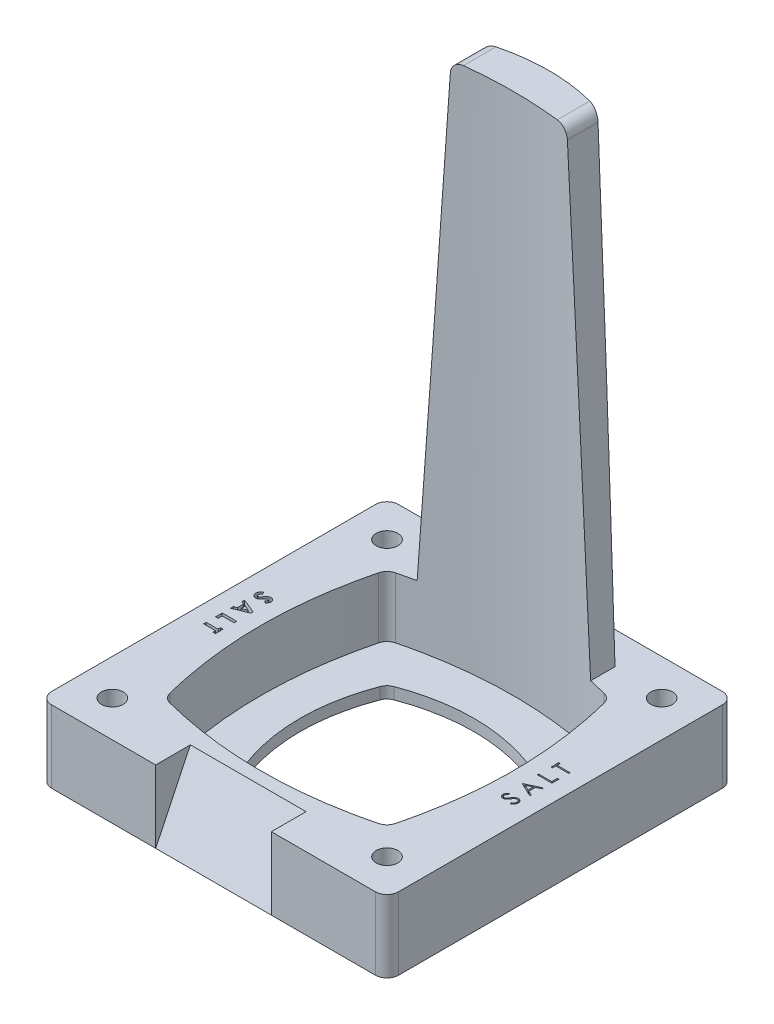
from build123d import *

# Parameters (mm, degrees)
SKETCH1_W           = 76.2
SKETCH1_H           = 76.2
BOSS_EXTRUDE1_DEPTH = 15.875
CUT_EXTRUDE1_DEPTH  = 13.335
SKETCH4_R           = 2.38125
CUT_EXTRUDE3_DEPTH  = 57.171484227
FILLET2_R           = 2.54
CUT_EXTRUDE4_DEPTH  = 56.507136865
FILLET3_R           = 2.54
BOSS_EXTRUDE2_DEPTH = 101.6
CUT_EXTRUDE5_DEPTH  = 130.242391125
FILLET4_R           = 2.54
CUT_EXTRUDE6_DEPTH  = 12.7
CUT_EXTRUDE7_DEPTH  = 1.27


with BuildPart() as part:
    # Sketch1 → Boss-Extrude1 (new body)
    with BuildSketch(Plane(origin=(0, 0, 0), x_dir=(1, 0, 0), z_dir=(0, 1, 0))):
        Rectangle(SKETCH1_W, SKETCH1_H)
    extrude(amount=BOSS_EXTRUDE1_DEPTH)

    # Sketch2 → Cut-Extrude1 (cut)
    with BuildSketch(Plane(origin=(0, 15.875, 0), x_dir=(1, 0, 0), z_dir=(0, 1, 0))):
        with BuildLine():
            add(Edge.make_bspline(
                [(-24.384, 24.384), (-30.988, 0), (-24.384, -24.384)],
                knots=[0, 0, 0, 1, 1, 1], degree=2))
            add(Edge.make_bspline(
                [(24.384, -24.384), (0, -30.988), (-24.384, -24.384)],
                knots=[0, 0, 0, 1, 1, 1], degree=2))
            add(Edge.make_bspline(
                [(24.384, 24.384), (30.988, 0), (24.384, -24.384)],
                knots=[0, 0, 0, 1, 1, 1], degree=2))
            add(Edge.make_bspline(
                [(-24.384, 24.384), (0, 30.988), (24.384, 24.384)],
                knots=[0, 0, 0, 1, 1, 1], degree=2))
        make_face()
    extrude(amount=-CUT_EXTRUDE1_DEPTH, mode=Mode.SUBTRACT)

    # Sketch4 → Cut-Extrude3 (cut, through all)
    with BuildSketch(Plane(origin=(0, 15.875, 0), x_dir=(1, 0, 0), z_dir=(0, 1, 0))):
        with Locations(Location((-30.1625, 30.1625, 0), (0, 0, 270))):
            Circle(SKETCH4_R)
        with Locations(Location((30.1625, 30.1625, 0), (0, 0, 270))):
            Circle(SKETCH4_R)
        with Locations(Location((30.1625, -30.1625, 0), (0, 0, 270))):
            Circle(SKETCH4_R)
        with Locations(Location((-30.1625, -30.1625, 0), (0, 0, 270))):
            Circle(SKETCH4_R)
    extrude(amount=-CUT_EXTRUDE3_DEPTH, mode=Mode.SUBTRACT)

    # Fillet2
    fillet2_edges = [part.edges().sort_by_distance(p)[0] for p in [
        (38.1, 7.9375, 38.1),
        (-38.1, 7.9375, 38.1),
        (-38.1, 7.9375, -38.1),
        (38.1, 7.9375, -38.1),
    ]]
    fillet(fillet2_edges, radius=FILLET2_R)

    # Sketch8 → Cut-Extrude4 (cut, through all)
    with BuildSketch(Plane(origin=(0, 2.54, 0), x_dir=(1, 0, 0), z_dir=(0, 1, 0))):
        with BuildLine():
            add(Edge.make_bspline(
                [(-15.875, 15.875), (-22.225, 0), (-15.875, -15.875)],
                knots=[0, 0, 0, 1, 1, 1], degree=2))
            add(Edge.make_bspline(
                [(15.875, -15.875), (0, -22.225), (-15.875, -15.875)],
                knots=[0, 0, 0, 1, 1, 1], degree=2))
            add(Edge.make_bspline(
                [(15.875, 15.875), (22.225, 0), (15.875, -15.875)],
                knots=[0, 0, 0, 1, 1, 1], degree=2))
            add(Edge.make_bspline(
                [(-15.875, 15.875), (0, 22.225), (15.875, 15.875)],
                knots=[0, 0, 0, 1, 1, 1], degree=2))
        make_face()
    extrude(amount=-CUT_EXTRUDE4_DEPTH, mode=Mode.SUBTRACT)

    # Fillet3
    fillet3_edges = [part.edges().sort_by_distance(p)[0] for p in [
        (15.875, 1.27, -15.875),
        (15.875, 1.27, 15.875),
        (-15.875, 1.27, 15.875),
        (-15.875, 1.27, -15.875),
        (-24.384, 9.2075, -24.384),
        (-24.384, 9.2075, 24.384),
        (24.384, 9.2075, 24.384),
        (24.384, 9.2075, -24.384),
    ]]
    fillet(fillet3_edges, radius=FILLET3_R)

    # Sketch9 → Boss-Extrude2 (add)
    with BuildSketch(Plane(origin=(0, 15.875, 0), x_dir=(1, 0, 0), z_dir=(0, 1, 0))):
        with BuildLine():
            Line((-26.67, 26.67), (-24.384, 24.384))
            add(Edge.make_bspline(
                [(-24.384, 24.384), (0, 30.988), (24.384, 24.384)],
                knots=[0, 0, 0, 1, 1, 1], degree=2))
            Line((24.384, 24.384), (26.67, 26.67))
            add(Edge.make_bspline(
                [(-26.67, 26.67), (0, 44.45), (26.67, 26.67)],
                knots=[0, 0, 0, 1, 1, 1], degree=2))
        make_face()
    extrude(amount=BOSS_EXTRUDE2_DEPTH)

    # Sketch10 → Cut-Extrude5 (cut, through all)
    with BuildSketch(Plane.XY):
        Polygon((-12.7, 117.475), (-19.05, 15.875), (-26.67, 15.875), (-26.67, 117.475), align=None)
        Polygon((12.7, 117.475), (19.05, 15.875), (26.67, 15.875), (26.67, 117.475), align=None)
    extrude(amount=-CUT_EXTRUDE5_DEPTH, mode=Mode.SUBTRACT)

    # Fillet4
    fillet4_edges = [part.edges().sort_by_distance(p)[0] for p in [
        (12.7, 117.475, -30.167201079),
        (-12.7, 117.475, -30.167201079),
    ]]
    fillet(fillet4_edges, radius=FILLET4_R)

    # Sketch11 → Cut-Extrude6 (cut, symmetric)
    with BuildSketch(Plane(origin=(0, 0, 0), x_dir=(0, 0, -1), z_dir=(1, 0, 0))):
        Polygon((-30.48, 15.875), (-38.1, 0), (-38.1, 15.875), align=None)
    extrude(amount=CUT_EXTRUDE6_DEPTH, both=True, mode=Mode.SUBTRACT)

    # Sketch12 → Cut-Extrude7 (cut)
    # profile 1 of 8: a face of its own
    with BuildSketch(Plane(origin=(0, 15.875, 0), x_dir=(1, 0, 0), z_dir=(0, 1, 0))):
        with BuildLine():
            Line((-31.539223758, 4.701442308), (-31.929102564, 5.127574119))
            add(Edge.make_bspline(
                [(-31.929102564, 5.127574119), (-31.90334928, 5.145824266), (-31.853906565, 5.180862003), (-31.787773878, 5.237711608), (-31.730987674, 5.294221577), (-31.685171539, 5.351547314), (-31.648288106, 5.40870185), (-31.622848116, 5.466899463), (-31.606487506, 5.525470629), (-31.604460135, 5.564842079), (-31.603461538, 5.584234776)],
                knots=[0, 0, 0, 0, 1.299459705, 2.494781419, 3.587730629, 4.594196874, 5.512431013, 6.380462003, 7.202284646, 8, 8, 8, 8], degree=3))
            add(Edge.make_bspline(
                [(-31.603461538, 5.584234776), (-31.604095863, 5.602322209), (-31.605320578, 5.63724429), (-31.617494153, 5.687028307), (-31.638503956, 5.731227267), (-31.66597604, 5.769798033), (-31.699073533, 5.80035177), (-31.733784293, 5.824746559), (-31.772097121, 5.838482876), (-31.798411918, 5.840290845), (-31.811439303, 5.841185897)],
                knots=[0, 0, 0, 0, 1.185010067, 2.2879431, 3.333075148, 4.379039566, 5.372662701, 6.27520591, 7.14612461, 8, 8, 8, 8], degree=3))
            add(Edge.make_bspline(
                [(-31.811439303, 5.841185897), (-31.824654549, 5.840625014), (-31.851268217, 5.839495472), (-31.890273863, 5.828585633), (-31.92838692, 5.812141391), (-31.951588151, 5.796428246), (-31.963447516, 5.788396434)],
                knots=[0, 0, 0, 0, 0.967525499, 1.948461899, 2.951351359, 4, 4, 4, 4], degree=3))
            add(Edge.make_bspline(
                [(-31.963447516, 5.788396434), (-31.972664567, 5.781093581), (-31.993881002, 5.764283377), (-32.027514428, 5.732259336), (-32.068440273, 5.691986792), (-32.116434363, 5.642638643), (-32.170871405, 5.584275433), (-32.232069818, 5.516380632), (-32.300413726, 5.439913482), (-32.348070362, 5.385624433), (-32.373042869, 5.357176482)],
                knots=[0, 0, 0, 0, 0.473868417, 1.090782513, 1.870421581, 2.78911798, 3.865477667, 5.087766164, 6.473963263, 8, 8, 8, 8], degree=3))
            add(Edge.make_bspline(
                [(-32.373042869, 5.357176482), (-32.396157108, 5.330468699), (-32.440023131, 5.279782876), (-32.502283908, 5.207667015), (-32.558298411, 5.144289184), (-32.607225982, 5.088726112), (-32.649579984, 5.041820082), (-32.685562867, 5.003373901), (-32.714474112, 4.972918012), (-32.731936522, 4.955605623), (-32.739389022, 4.948217147)],
                knots=[0, 0, 0, 0, 1.543621617, 2.929473131, 4.163658386, 5.240097082, 6.164993805, 6.925417477, 7.541396219, 8, 8, 8, 8], degree=3))
            add(Edge.make_bspline(
                [(-32.739389022, 4.948217147), (-32.769712969, 4.920170829), (-32.828006242, 4.866255955), (-32.918609813, 4.796365702), (-33.006450958, 4.737968856), (-33.094228703, 4.693264821), (-33.182997385, 4.660542209), (-33.274285521, 4.636575422), (-33.369659972, 4.622422931), (-33.434721592, 4.620835142), (-33.467629207, 4.620032051)],
                knots=[0, 0, 0, 0, 1.20648512, 2.3192881, 3.339983362, 4.284774958, 5.190427137, 6.099526693, 7.038756749, 8, 8, 8, 8], degree=3))
            add(Edge.make_bspline(
                [(-33.467629207, 4.620032051), (-33.499695024, 4.620600768), (-33.562609351, 4.621716613), (-33.654679367, 4.635368766), (-33.742778036, 4.654863757), (-33.826022738, 4.684903259), (-33.905400171, 4.721824111), (-33.980936356, 4.766821951), (-34.050870359, 4.821835457), (-34.117079432, 4.882942605), (-34.17653746, 4.951577998), (-34.228852022, 5.025427428), (-34.273370098, 5.104352997), (-34.308628113, 5.188649162), (-34.336940573, 5.277799923), (-34.357059122, 5.371917983), (-34.369491274, 5.471113411), (-34.370761379, 5.538828093), (-34.371410256, 5.573422476)],
                knots=[0, 0, 0, 0, 1.043082113, 2.046565928, 3.024368146, 3.976196322, 4.921091788, 5.871642728, 6.831173094, 7.81279273, 8.801063391, 9.781590382, 10.755046466, 11.74476232, 12.751114423, 13.796272686, 14.874149815, 16, 16, 16, 16], degree=3))
            add(Edge.make_bspline(
                [(-34.371410256, 5.573422476), (-34.370928674, 5.600577189), (-34.369974864, 5.654359094), (-34.362182929, 5.733624363), (-34.349619668, 5.810168261), (-34.331570529, 5.883884489), (-34.308908965, 5.954991454), (-34.280708006, 6.023423061), (-34.247515147, 6.089106849), (-34.209311506, 6.152465759), (-34.164977118, 6.213063076), (-34.115433842, 6.271713479), (-34.059607727, 6.327684393), (-33.998587537, 6.38212378), (-33.930809473, 6.433106757), (-33.858228699, 6.483247413), (-33.779134234, 6.530118687), (-33.723659024, 6.559083581), (-33.695323518, 6.573878205)],
                knots=[0, 0, 0, 0, 1.016957334, 2.014158747, 2.980235577, 3.920141478, 4.854360818, 5.773095257, 6.689355356, 7.608638744, 8.541033765, 9.498850575, 10.481527934, 11.499755671, 12.559141621, 13.65604909, 14.802761907, 16, 16, 16, 16], degree=3))
            Line((-33.695323518, 6.573878205), (-33.394487179, 6.072696314))
            add(Edge.make_bspline(
                [(-33.394487179, 6.072696314), (-33.426652663, 6.054191679), (-33.488316645, 6.018716711), (-33.57117002, 5.958601062), (-33.642120221, 5.897015649), (-33.699913198, 5.832536672), (-33.745321719, 5.765948171), (-33.777773798, 5.696928508), (-33.797861598, 5.625429192), (-33.800314782, 5.576727106), (-33.801538462, 5.552433894)],
                knots=[0, 0, 0, 0, 1.283663364, 2.460892379, 3.537111102, 4.529833553, 5.449777664, 6.316464042, 7.160231139, 8, 8, 8, 8], degree=3))
            add(Edge.make_bspline(
                [(-33.801538462, 5.552433894), (-33.800548635, 5.52771967), (-33.798628227, 5.479770474), (-33.78053993, 5.411216463), (-33.75277678, 5.348088088), (-33.712399548, 5.293813718), (-33.666357758, 5.247724344), (-33.61442987, 5.214682999), (-33.5589196, 5.193250233), (-33.520183941, 5.191023677), (-33.500702123, 5.189903846)],
                knots=[0, 0, 0, 0, 1.13537643, 2.202795631, 3.242191317, 4.290390765, 5.297919085, 6.223733717, 7.106639842, 8, 8, 8, 8], degree=3))
            add(Edge.make_bspline(
                [(-33.500702123, 5.189903846), (-33.482586559, 5.190952039), (-33.445786526, 5.193081344), (-33.391039028, 5.208679787), (-33.336556999, 5.233269536), (-33.291396406, 5.261489162), (-33.253753173, 5.290909641), (-33.221627446, 5.319747347), (-33.185391531, 5.353925017), (-33.146033543, 5.394313515), (-33.102796752, 5.440127294), (-33.055783958, 5.491516336), (-33.005378385, 5.549034055), (-32.971044009, 5.589689326), (-32.953090946, 5.610947516)],
                knots=[0, 0, 0, 0, 0.916057066, 1.860882232, 2.859899639, 3.934694552, 4.546382938, 5.276161949, 6.118633209, 7.067046139, 8.129668089, 9.306861125, 10.591787583, 12, 12, 12, 12], degree=3))
            add(Edge.make_bspline(
                [(-32.953090946, 5.610947516), (-32.918896967, 5.651358634), (-32.853268374, 5.7289198), (-32.756356584, 5.838543679), (-32.665714834, 5.937253946), (-32.580623832, 6.024400518), (-32.501608539, 6.100215791), (-32.42942167, 6.165618041), (-32.362598747, 6.219183137), (-32.283317923, 6.275493452), (-32.187216408, 6.329855646), (-32.070979105, 6.37596492), (-31.955004328, 6.406047538), (-31.877121446, 6.409405117), (-31.838788061, 6.411057692)],
                knots=[0, 0, 0, 0, 1.34561873, 2.582649632, 3.719171478, 4.751946187, 5.678152813, 6.502542634, 7.227205346, 7.853698961, 8.973370308, 10.023159194, 11.027013428, 12, 12, 12, 12], degree=3))
            add(Edge.make_bspline(
                [(-31.838788061, 6.411057692), (-31.811605937, 6.410367884), (-31.758054232, 6.409008887), (-31.679305232, 6.396921899), (-31.603354152, 6.378774417), (-31.530224114, 6.352691733), (-31.460724416, 6.317721035), (-31.393785558, 6.276365202), (-31.329524181, 6.227770596), (-31.270035587, 6.171367484), (-31.214773717, 6.110180427), (-31.166266245, 6.04464606), (-31.125470412, 5.975448668), (-31.09113176, 5.903077734), (-31.065288948, 5.826603231), (-31.046806835, 5.746720168), (-31.03584309, 5.663405528), (-31.034350217, 5.606740109), (-31.033589744, 5.577874599)],
                knots=[0, 0, 0, 0, 1.010961173, 1.991702108, 2.958025473, 3.913824419, 4.873522744, 5.847800578, 6.838738273, 7.865764422, 8.893759806, 9.903642949, 10.894078012, 11.878777586, 12.879248405, 13.891624672, 14.925988217, 16, 16, 16, 16], degree=3))
            add(Edge.make_bspline(
                [(-31.033589744, 5.577874599), (-31.034961925, 5.540467807), (-31.037695458, 5.465949499), (-31.058958268, 5.355738895), (-31.092751805, 5.248038904), (-31.132550524, 5.160976676), (-31.172352352, 5.092314817), (-31.208195551, 5.039515356), (-31.249513552, 4.985684305), (-31.296471034, 4.930544243), (-31.348754388, 4.874375385), (-31.407426808, 4.817650355), (-31.470575803, 4.758987322), (-31.515940238, 4.720960012), (-31.539223758, 4.701442308)],
                knots=[0, 0, 0, 0, 1.282867522, 2.555608537, 3.83715526, 5.14906667, 5.830341525, 6.558732832, 7.337173124, 8.157810814, 9.043130442, 9.96912168, 10.957641678, 12, 12, 12, 12], degree=3))
        make_face()
    # profile 2 of 8: a face of its own
    with BuildSketch(Plane(origin=(0, 15.875, 0), x_dir=(1, 0, 0), z_dir=(0, 1, 0))):
        Polygon((-31.115, 1.729331931), (-31.115, 1.200801282), (-34.29, -0.081410256), (-34.29, 0.527258614), (-33.638717949, 0.774033454), (-33.638717949, 2.157371795), (-34.29, 2.404146635), (-34.29, 3.012179487), align=None)
        Polygon((-31.966627604, 1.465384615), (-33.068846154, 1.941125801), (-33.068846154, 0.989643429), align=None, mode=Mode.SUBTRACT)
    # profile 3 of 8: a face of its own
    with BuildSketch(Plane(origin=(0, 15.875, 0), x_dir=(1, 0, 0), z_dir=(0, 1, 0))):
        Polygon((-31.115, -1.892788462), (-31.115, -2.462660256), (-33.720128205, -2.462660256), (-33.720128205, -3.358173077), (-34.29, -3.358173077), (-34.29, -1.892788462), align=None)
    # profile 4 of 8: a face of its own
    with BuildSketch(Plane(origin=(0, 15.875, 0), x_dir=(1, 0, 0), z_dir=(0, 1, 0))):
        Polygon((-31.115, -4.864262821), (-31.115, -6.573878205), (-31.684871795, -6.573878205), (-31.684871795, -6.00400641), (-34.29, -6.00400641), (-34.29, -5.434134615), (-31.684871795, -5.434134615), (-31.684871795, -4.864262821), align=None)
    # profile 5 of 8: a face of its own
    with BuildSketch(Plane(origin=(0, 15.875, 0), x_dir=(1, 0, 0), z_dir=(0, 1, 0))):
        Polygon((31.440641026, 4.945673077), (31.115, 4.945673077), (31.115, 6.614583333), (31.440641026, 6.614583333), (31.440641026, 5.922596154), (34.29, 5.922596154), (34.29, 5.637660256), (31.440641026, 5.637660256), align=None)
    # profile 6 of 8: a face of its own
    with BuildSketch(Plane(origin=(0, 15.875, 0), x_dir=(1, 0, 0), z_dir=(0, 1, 0))):
        Polygon((31.115, 1.93349359), (31.115, 2.218429487), (33.964358974, 2.218429487), (33.964358974, 3.439583333), (34.29, 3.439583333), (34.29, 1.93349359), align=None)
    # profile 7 of 8: a face of its own
    with BuildSketch(Plane(origin=(0, 15.875, 0), x_dir=(1, 0, 0), z_dir=(0, 1, 0))):
        Polygon((31.115, -1.363621795), (34.29, 0.101762821), (34.29, -0.207977764), (33.272371795, -0.677358774), (33.272371795, -2.116666667), (34.29, -2.599404046), (34.29, -2.910416667), (31.115, -1.404326923), align=None)
        Polygon((31.733845152, -1.387154447), (32.946730769, -1.962114383), (32.946730769, -0.827458934), align=None, mode=Mode.SUBTRACT)
    # profile 8 of 8: a face of its own
    with BuildSketch(Plane(origin=(0, 15.875, 0), x_dir=(1, 0, 0), z_dir=(0, 1, 0))):
        with BuildLine():
            Line((33.677515024, -6.533173077), (33.516602564, -6.264773638))
            add(Edge.make_bspline(
                [(33.516602564, -6.264773638), (33.558389542, -6.239810665), (33.638451779, -6.191982574), (33.746635858, -6.112198127), (33.838585815, -6.029527557), (33.913766737, -5.943358662), (33.972956799, -5.854217409), (34.014868823, -5.761521874), (34.04100903, -5.665584432), (34.044184108, -5.600293894), (34.045769231, -5.567698317)],
                knots=[0, 0, 0, 0, 1.272034388, 2.437168799, 3.508375237, 4.49857839, 5.41946034, 6.295179144, 7.148887113, 8, 8, 8, 8], degree=3))
            add(Edge.make_bspline(
                [(34.045769231, -5.567698317), (34.044975476, -5.539866587), (34.043401854, -5.484690115), (34.028892285, -5.403302257), (34.005154659, -5.324653869), (33.972975737, -5.249526766), (33.933420845, -5.179911324), (33.886778206, -5.117886425), (33.832884305, -5.065512974), (33.773735657, -5.02209475), (33.71030847, -4.988498044), (33.644955763, -4.963105327), (33.576780848, -4.948884037), (33.53086809, -4.946750009), (33.507698317, -4.945673077)],
                knots=[0, 0, 0, 0, 1.09553864, 2.171907928, 3.244545276, 4.325730702, 5.384330216, 6.391480148, 7.371786628, 8.333890167, 9.27165687, 10.191402356, 11.087295184, 12, 12, 12, 12], degree=3))
            add(Edge.make_bspline(
                [(33.507698317, -4.945673077), (33.48125458, -4.946981763), (33.42770313, -4.949631994), (33.348559073, -4.972988658), (33.269898664, -5.008653308), (33.221232969, -5.04217407), (33.196049679, -5.059520232)],
                knots=[0, 0, 0, 0, 0.938992559, 1.901562324, 2.914110574, 4, 4, 4, 4], degree=3))
            add(Edge.make_bspline(
                [(33.196049679, -5.059520232), (33.177862047, -5.073733634), (33.139679389, -5.103572893), (33.082891582, -5.154915228), (33.024196314, -5.214855243), (32.962305017, -5.282572562), (32.897731753, -5.358180777), (32.829972625, -5.44170914), (32.760412297, -5.533870518), (32.713820333, -5.598558279), (32.689779647, -5.631936098)],
                knots=[0, 0, 0, 0, 0.72225051, 1.516274602, 2.393638633, 3.3469932, 4.386926276, 5.505032946, 6.712638081, 8, 8, 8, 8], degree=3))
            add(Edge.make_bspline(
                [(32.689779647, -5.631936098), (32.665986572, -5.665340723), (32.620496022, -5.729207822), (32.552982565, -5.818523822), (32.491257054, -5.898392728), (32.434738415, -5.96845955), (32.38341898, -6.02869347), (32.337791564, -6.079569136), (32.296622191, -6.119790541), (32.269914688, -6.142156675), (32.257923678, -6.152198518)],
                knots=[0, 0, 0, 0, 1.452282411, 2.77665338, 3.964542531, 5.026858415, 5.96415736, 6.766646006, 7.446254459, 8, 8, 8, 8], degree=3))
            add(Edge.make_bspline(
                [(32.257923678, -6.152198518), (32.239234667, -6.166231974), (32.202480218, -6.193830649), (32.145048745, -6.230300478), (32.086370132, -6.261055584), (32.026231713, -6.285807694), (31.965085465, -6.305823787), (31.902472326, -6.319740107), (31.838817351, -6.328317833), (31.795989444, -6.329203887), (31.77455028, -6.329647436)],
                knots=[0, 0, 0, 0, 1.068019517, 2.100403715, 3.106014851, 4.09224787, 5.069873182, 6.043214339, 7.020455327, 8, 8, 8, 8], degree=3))
            add(Edge.make_bspline(
                [(31.77455028, -6.329647436), (31.740958919, -6.328463478), (31.674494189, -6.326120867), (31.577402888, -6.306307633), (31.484701659, -6.275038644), (31.397329623, -6.231217577), (31.317482025, -6.1747813), (31.244440161, -6.109186503), (31.182197866, -6.031782855), (31.128662953, -5.946091262), (31.086327298, -5.852787901), (31.055646501, -5.754559751), (31.037422493, -5.652112907), (31.03487988, -5.582611273), (31.033589744, -5.547345753)],
                knots=[0, 0, 0, 0, 1.005248779, 1.989011071, 2.95484373, 3.928844559, 4.904706341, 5.875556129, 6.859318422, 7.868909462, 8.894684146, 9.918924798, 10.944050749, 12, 12, 12, 12], degree=3))
            add(Edge.make_bspline(
                [(31.033589744, -5.547345753), (31.034862679, -5.509925404), (31.03739414, -5.435508273), (31.059952317, -5.326219585), (31.095854676, -5.220566822), (31.137977549, -5.135952853), (31.179780446, -5.069589547), (31.217939056, -5.019029853), (31.261777906, -4.967516671), (31.312221185, -4.915603615), (31.368259979, -4.862778194), (31.430368658, -4.809283736), (31.497987524, -4.754619624), (31.546271815, -4.719464498), (31.571024639, -4.701442308)],
                knots=[0, 0, 0, 0, 1.286507425, 2.558452658, 3.822738219, 5.118007103, 5.800084425, 6.519418873, 7.295692132, 8.12638276, 9.008892966, 9.945018126, 10.946518512, 12, 12, 12, 12], degree=3))
            Line((31.571024639, -4.701442308), (31.766282051, -4.959029447))
            add(Edge.make_bspline(
                [(31.766282051, -4.959029447), (31.746243294, -4.974582123), (31.707653332, -5.004532941), (31.653629065, -5.050022631), (31.604213272, -5.09283279), (31.561404692, -5.135333914), (31.521997652, -5.17425003), (31.488857607, -5.212691275), (31.46093749, -5.249174198), (31.43108717, -5.295050465), (31.402392591, -5.353165186), (31.377187777, -5.425508662), (31.362234936, -5.501366059), (31.360240457, -5.553004915), (31.359230769, -5.579146635)],
                knots=[0, 0, 0, 0, 1.181392137, 2.275085037, 3.289537922, 4.225335853, 5.084247276, 5.86831218, 6.587234301, 7.222706459, 8.415108401, 9.595592188, 10.782789524, 12, 12, 12, 12], degree=3))
            add(Edge.make_bspline(
                [(31.359230769, -5.579146635), (31.360311956, -5.611953506), (31.362396922, -5.675218466), (31.385767075, -5.764826937), (31.421299819, -5.845944964), (31.472537664, -5.915475881), (31.533623045, -5.972886481), (31.60328662, -6.014930463), (31.680227328, -6.040067821), (31.733873021, -6.04314459), (31.76119391, -6.044711538)],
                knots=[0, 0, 0, 0, 1.144248881, 2.206576175, 3.214949548, 4.222996039, 5.203671638, 6.127710127, 7.046472867, 8, 8, 8, 8], degree=3))
            add(Edge.make_bspline(
                [(31.76119391, -6.044711538), (31.778200279, -6.044334544), (31.812449923, -6.043575302), (31.862810058, -6.033873426), (31.91290466, -6.020755691), (31.962557422, -6.000645575), (32.012892698, -5.972640574), (32.064621432, -5.93590401), (32.118189187, -5.889625349), (32.153030249, -5.854177261), (32.17142528, -5.835461739)],
                knots=[0, 0, 0, 0, 0.858259122, 1.72847414, 2.583651051, 3.473048463, 4.427392529, 5.488649985, 6.674082839, 8, 8, 8, 8], degree=3))
            add(Edge.make_bspline(
                [(32.17142528, -5.835461739), (32.17762744, -5.82851178), (32.19236235, -5.812000267), (32.216485347, -5.781814249), (32.246242148, -5.741951853), (32.283060642, -5.693453999), (32.325770254, -5.635426464), (32.373824888, -5.567862867), (32.428784555, -5.491516333), (32.467208895, -5.437340024), (32.487526042, -5.40869391)],
                knots=[0, 0, 0, 0, 0.420754252, 0.999615792, 1.744751191, 2.668019286, 3.750313428, 4.999500688, 6.413464383, 8, 8, 8, 8], degree=3))
            add(Edge.make_bspline(
                [(32.487526042, -5.40869391), (32.512600721, -5.374235285), (32.561154363, -5.307510932), (32.634102633, -5.212571227), (32.705448215, -5.126490113), (32.77473086, -5.048958996), (32.841440523, -4.979233255), (32.906328062, -4.918015765), (32.968967955, -4.865028769), (33.048730082, -4.80720544), (33.147598158, -4.748821019), (33.268784801, -4.698761177), (33.390319212, -4.666913962), (33.471899388, -4.662777888), (33.512150441, -4.660737179)],
                knots=[0, 0, 0, 0, 1.163604038, 2.253157948, 3.268574773, 4.215621239, 5.091738613, 5.902582348, 6.650434646, 7.330118262, 8.591011492, 9.77460283, 10.902005569, 12, 12, 12, 12], degree=3))
            add(Edge.make_bspline(
                [(33.512150441, -4.660737179), (33.540614799, -4.661333905), (33.596990757, -4.662515769), (33.679776533, -4.67607862), (33.760161086, -4.695995746), (33.837071298, -4.725773506), (33.911741215, -4.762711029), (33.982764199, -4.808909235), (34.051520076, -4.862738889), (34.11608126, -4.924456238), (34.175421306, -4.991954625), (34.22798888, -5.063552554), (34.272829442, -5.138502607), (34.308540552, -5.217616442), (34.336658792, -5.300044167), (34.356974817, -5.386057598), (34.369457457, -5.475743866), (34.370752056, -5.536704647), (34.371410256, -5.567698317)],
                knots=[0, 0, 0, 0, 0.983922938, 1.948738757, 2.895227473, 3.844781104, 4.796118043, 5.772795661, 6.770647148, 7.813532943, 8.8582745, 9.876489951, 10.882905461, 11.874265028, 12.874055871, 13.891769171, 14.928133632, 16, 16, 16, 16], degree=3))
            add(Edge.make_bspline(
                [(34.371410256, -5.567698317), (34.370946542, -5.59167895), (34.370024952, -5.639338203), (34.361877648, -5.709831806), (34.350350487, -5.778901287), (34.332049735, -5.84567997), (34.309845579, -5.911028145), (34.282505961, -5.974661889), (34.249741912, -6.036610943), (34.21228368, -6.097226678), (34.168679669, -6.156338684), (34.117938677, -6.213456617), (34.061354584, -6.270083092), (33.998053261, -6.325816418), (33.927338615, -6.37944067), (33.850263967, -6.432243195), (33.766600116, -6.483966663), (33.707764695, -6.516464581), (33.677515024, -6.533173077)],
                knots=[0, 0, 0, 0, 0.915313873, 1.819100311, 2.706792138, 3.586475221, 4.459428225, 5.3405999, 6.2277379, 7.133009489, 8.059106158, 9.028520402, 10.047404263, 11.114294124, 12.246039232, 13.433834781, 14.680630578, 16, 16, 16, 16], degree=3))
        make_face()
    extrude(amount=-CUT_EXTRUDE7_DEPTH, mode=Mode.SUBTRACT)


solid = part.part
